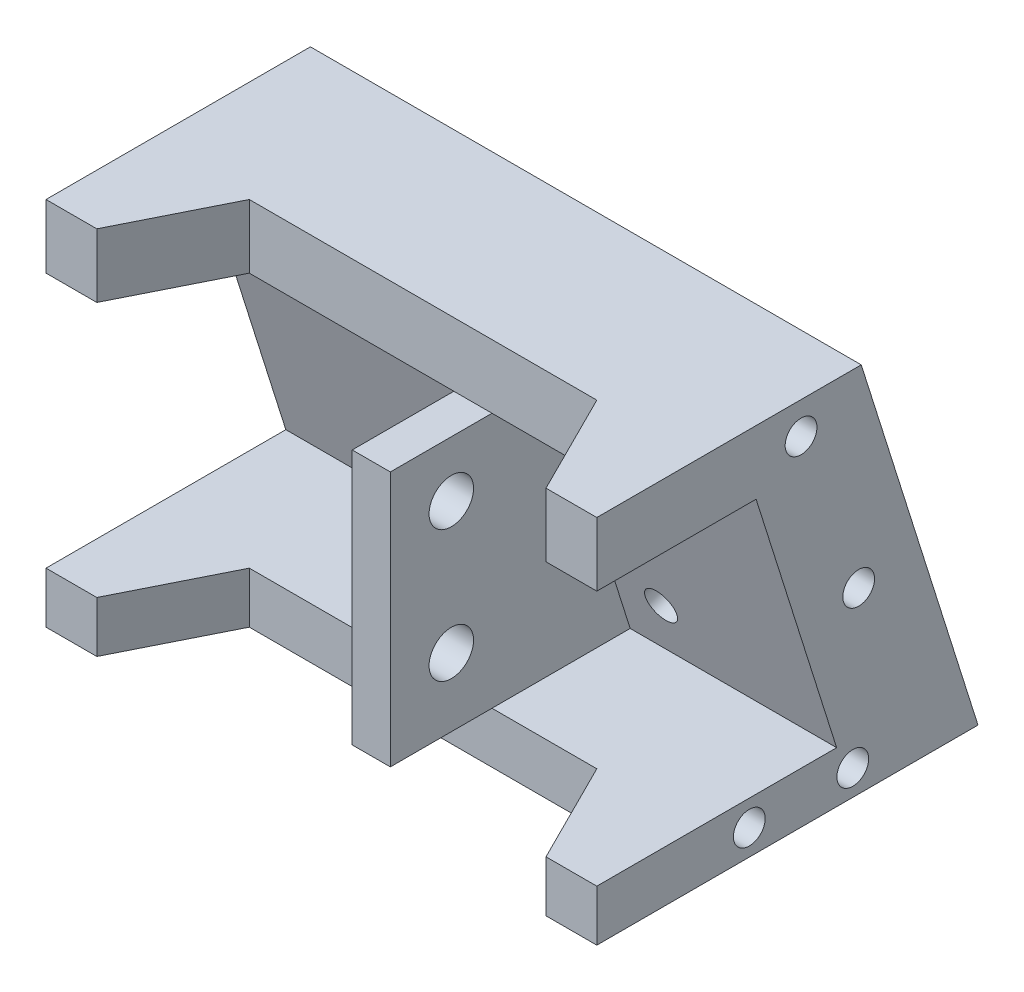
from build123d import *

# Parameters (mm, degrees)
SKETCH1_W            = 43.35
SKETCH1_H            = 29.15
BOSS_EXTRUDE1_DEPTH  = 30
CUT_EXTRUDE6_DEPTH   = 28.13
SKETCH11_W           = 18.87556933
SKETCH11_H           = 20.106349468
CUT_EXTRUDE8_DEPTH   = 50
SKETCH14_W           = 3
SKETCH14_H           = 29.15
BOSS_EXTRUDE5_DEPTH  = 30
SKETCH15_W           = 8
SKETCH15_H           = 4.023650532
CUT_EXTRUDE10_DEPTH  = 5
SKETCH16_W           = 8
SKETCH16_H           = 4
CUT_EXTRUDE11_DEPTH  = 5
SKETCH17_R           = 1.75
CUT_EXTRUDE12_DEPTH  = 5
CUT_EXTRUDE14_DEPTH  = 50
SKETCH30_R           = 1.25
CUT_EXTRUDE23_DEPTH  = 45
SKETCH31_R           = 1.25
CUT_EXTRUDE24_DEPTH  = 50
SKETCH32_R           = 1.25
CUT_EXTRUDE25_DEPTH  = 50
CUT_EXTRUDE29_DEPTH  = 5
BOSS_EXTRUDE13_DEPTH = 24.1
BOSS_EXTRUDE14_DEPTH = 16.25
SKETCH74_R           = 1.250000003
CUT_EXTRUDE30_DEPTH  = 10


with BuildPart() as part:
    # Sketch1 → Boss-Extrude1 (new body)
    with BuildSketch(Plane.XY):
        with Locations((-32.56399028, -14.719171637)):
            Rectangle(SKETCH1_W, SKETCH1_H)
    extrude(amount=-BOSS_EXTRUDE1_DEPTH)

    # Sketch9 → Cut-Extrude6 (cut)
    with BuildSketch(Plane.XZ.offset(29.294171637)):
        Polygon((-14.88899028, 0), (-18.88899028, -8), (-46.23899028, -8), (-50.23899028, 0), align=None)
    extrude(amount=-CUT_EXTRUDE6_DEPTH, mode=Mode.SUBTRACT)

    # Sketch11 → Cut-Extrude8 (cut)
    with BuildSketch(Plane.ZY.offset(54.23899028)):
        with Locations((-9.437784665, -15.217346371)):
            Rectangle(SKETCH11_W, SKETCH11_H)
    extrude(amount=-CUT_EXTRUDE8_DEPTH, mode=Mode.SUBTRACT)

    # Sketch14 → Boss-Extrude5 (add)
    with BuildSketch(Plane(origin=(0, 0, -30), x_dir=(-1, 0, 0), z_dir=(0, 0, -1))):
        with Locations((36.48899028, -14.719171637)):
            Rectangle(SKETCH14_W, SKETCH14_H)
    extrude(amount=-BOSS_EXTRUDE5_DEPTH)

    # Sketch15 → Cut-Extrude10 (cut)
    with BuildSketch(Plane.ZY.offset(37.98899028)):
        with Locations((-4, -27.282346371)):
            Rectangle(SKETCH15_W, SKETCH15_H)
    extrude(amount=-CUT_EXTRUDE10_DEPTH, mode=Mode.SUBTRACT)

    # Sketch16 → Cut-Extrude11 (cut)
    with BuildSketch(Plane.ZY.offset(37.98899028)):
        with Locations((-4, -3.164171637)):
            Rectangle(SKETCH16_W, SKETCH16_H)
    extrude(amount=-CUT_EXTRUDE11_DEPTH, mode=Mode.SUBTRACT)

    # Sketch17 → Cut-Extrude12 (cut)
    with BuildSketch(Plane.ZY.offset(37.98899028)):
        with Locations((-4.799999988, -19.899171637)):
            Circle(SKETCH17_R)
        with Locations((-4.799999989, -9.549171637)):
            Circle(SKETCH17_R)
    extrude(amount=-CUT_EXTRUDE12_DEPTH, mode=Mode.SUBTRACT)

    # Sketch20 → Cut-Extrude14 (cut)
    with BuildSketch(Plane.ZY.offset(54.23899028)):
        Polygon((-30, -29.294171637), (-30, -0.144171637), (-20.81, -0.144171637), align=None)
    extrude(amount=-CUT_EXTRUDE14_DEPTH, mode=Mode.SUBTRACT)

    # Sketch30 → Cut-Extrude23 (cut)
    with BuildSketch(Plane.ZY.offset(54.23899028)):
        with Locations(Location((-12.001192799, -27.284171637, 0), (0, 0, 270))):
            Circle(SKETCH30_R)
        with Locations(Location((-20.145814089, -27.284171637, 0), (0, 0, 270))):
            Circle(SKETCH30_R)
    extrude(amount=-CUT_EXTRUDE23_DEPTH, mode=Mode.SUBTRACT)

    # Sketch31 → Cut-Extrude24 (cut)
    with BuildSketch(Plane.ZY.offset(54.23899028)):
        with Locations(Location((-16.073503444, -2.654171637, 0), (0, 0, 270))):
            Circle(SKETCH31_R)
    extrude(amount=-CUT_EXTRUDE24_DEPTH, mode=Mode.SUBTRACT)

    # Sketch32 → Cut-Extrude25 (cut)
    with BuildSketch(Plane.ZY.offset(54.23899028)):
        with Locations(Location((-20.609812978, -15.243146641, 0), (0, 0, 270))):
            Circle(SKETCH32_R)
    extrude(amount=-CUT_EXTRUDE25_DEPTH, mode=Mode.SUBTRACT)

    # Sketch56 → Cut-Extrude29 (cut)
    with BuildSketch(Plane.XZ.offset(1.164171637)):
        Polygon((-14.88899028, 0), (-18.88899028, -8), (-46.23899028, -8), (-50.23899028, 0), align=None)
    extrude(amount=-CUT_EXTRUDE29_DEPTH, mode=Mode.SUBTRACT)

    # Sketch68 → Boss-Extrude13 (add)
    with BuildSketch(Plane(origin=(-34.98899028, 0, 0), x_dir=(0, 0, -1), z_dir=(1, 0, 0))):
        Polygon((18.87556933, -5.164171637), (12.53556933, -5.164171637), (18.87556933, -25.270521105), align=None)
    extrude(amount=BOSS_EXTRUDE13_DEPTH)

    # Sketch73 → Boss-Extrude14 (add)
    with BuildSketch(Plane.ZY.offset(37.98899028)):
        Polygon((-18.87556933, -5.164171637), (-12.53556933, -5.164171637), (-18.87556933, -25.270521105), align=None)
    extrude(amount=BOSS_EXTRUDE14_DEPTH)


with BuildPart() as body_2:
    # Mirror1: mirrored copy
    add(part.part.mirror(Plane(origin=(-10.88899028, -0.144171637, -30), x_dir=(0, 0, 1), z_dir=(1, 0, 0))))

    # Sketch74 → Cut-Extrude30 (cut)
    with BuildSketch(Plane(origin=(0, 5.954518238, -18.887291254), x_dir=(-1, 0, 0), z_dir=(0, 0.3006772394057975, -0.953725955242547))):
        with Locations(Location((-19.919214984, -25.5324432, 0), (0, 0, 90))):
            Circle(SKETCH74_R)
        with Locations(Location((-1.538214984, -25.532443188, 0), (0, 0, 90))):
            Circle(SKETCH74_R)
        with Locations(Location((-1.538214991, -14.26893462, 0), (0, 0, 90))):
            Circle(SKETCH74_R)
        with Locations(Location((-19.919214991, -14.268934632, 0), (0, 0, 90))):
            Circle(SKETCH74_R)
    extrude(amount=-CUT_EXTRUDE30_DEPTH, mode=Mode.SUBTRACT)


solid = body_2.part
